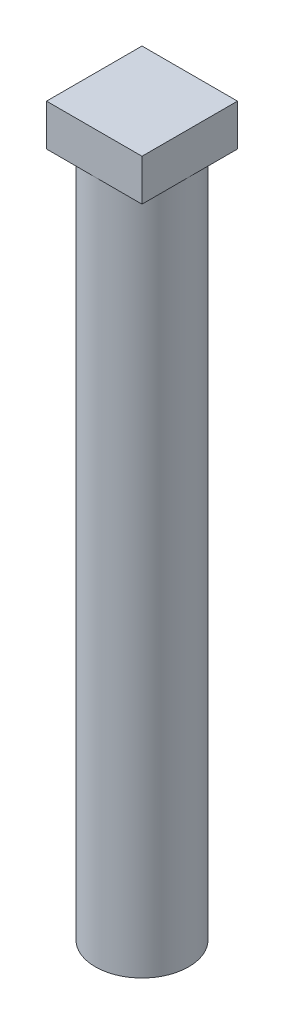
from build123d import *

# Parameters (mm, degrees)
SKETCH1_R           = 2.25
BOSS_EXTRUDE1_DEPTH = 35
SKETCH2_W           = 4.6
SKETCH2_H           = 4.6
BOSS_EXTRUDE2_DEPTH = 2


with BuildPart() as part:
    # Sketch1 → Boss-Extrude1 (new body)
    with BuildSketch(Plane(origin=(0, 0, 0), x_dir=(1, 0, 0), z_dir=(0, 1, 0))):
        with Locations(Location((0, 0, 0), (0, 0, 270))):
            Circle(SKETCH1_R)
    extrude(amount=BOSS_EXTRUDE1_DEPTH)

    # Sketch2 → Boss-Extrude2 (add)
    with BuildSketch(Plane(origin=(0, 35, 0), x_dir=(1, 0, 0), z_dir=(0, 1, 0))):
        Rectangle(SKETCH2_W, SKETCH2_H)
    extrude(amount=-BOSS_EXTRUDE2_DEPTH)


solid = part.part
